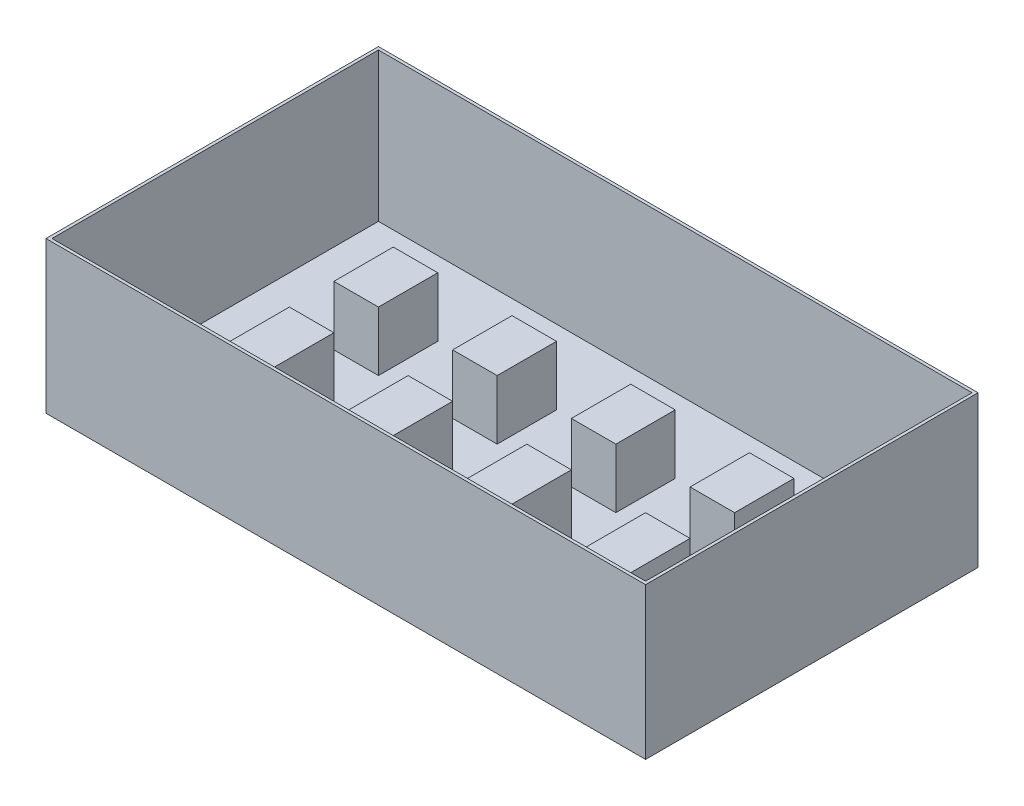
from build123d import *

# Parameters (mm, degrees)
SKETCH1_W            = 2000
SKETCH1_H            = 1100
BOSS_EXTRUDE1_DEPTH  = 500
SHELL1_T             = 10
SKETCH2_W            = 150
SKETCH2_H            = 200
BOSS_EXTRUDE2_DEPTH  = 200
LPATTERN1_COUNT      = 4
LPATTERN1_PITCH      = 400
LPATTERN1_COUNT_DIR2 = 2
LPATTERN1_PITCH_DIR2 = 350


with BuildPart() as part:
    # Sketch1 → Boss-Extrude1 (new body)
    with BuildSketch(Plane(origin=(0, 0, 0), x_dir=(1, 0, 0), z_dir=(0, 1, 0))):
        with Locations((1000, 550)):
            Rectangle(SKETCH1_W, SKETCH1_H)
    extrude(amount=BOSS_EXTRUDE1_DEPTH)

    # Shell1
    shell1_openings = [part.faces().sort_by_distance(p)[0] for p in [
        (1000, 500, -550),
    ]]
    offset(amount=SHELL1_T, openings=shell1_openings, kind=Kind.INTERSECTION)

    # Sketch2 → Boss-Extrude2 (add)
    with BuildSketch(Plane(origin=(0, 0, 0), x_dir=(1, 0, 0), z_dir=(0, 1, 0))):
        with Locations((375, 400)):
            Rectangle(SKETCH2_W, SKETCH2_H)
    boss_extrude2 = extrude(amount=BOSS_EXTRUDE2_DEPTH)

    # LPattern1: Boss-Extrude2 4 × 2
    with Locations(*[(i * LPATTERN1_PITCH, 0, -j * LPATTERN1_PITCH_DIR2) for i in range(LPATTERN1_COUNT) for j in range(LPATTERN1_COUNT_DIR2) if (i, j) != (0, 0)]):
        add(boss_extrude2)


solid = part.part
